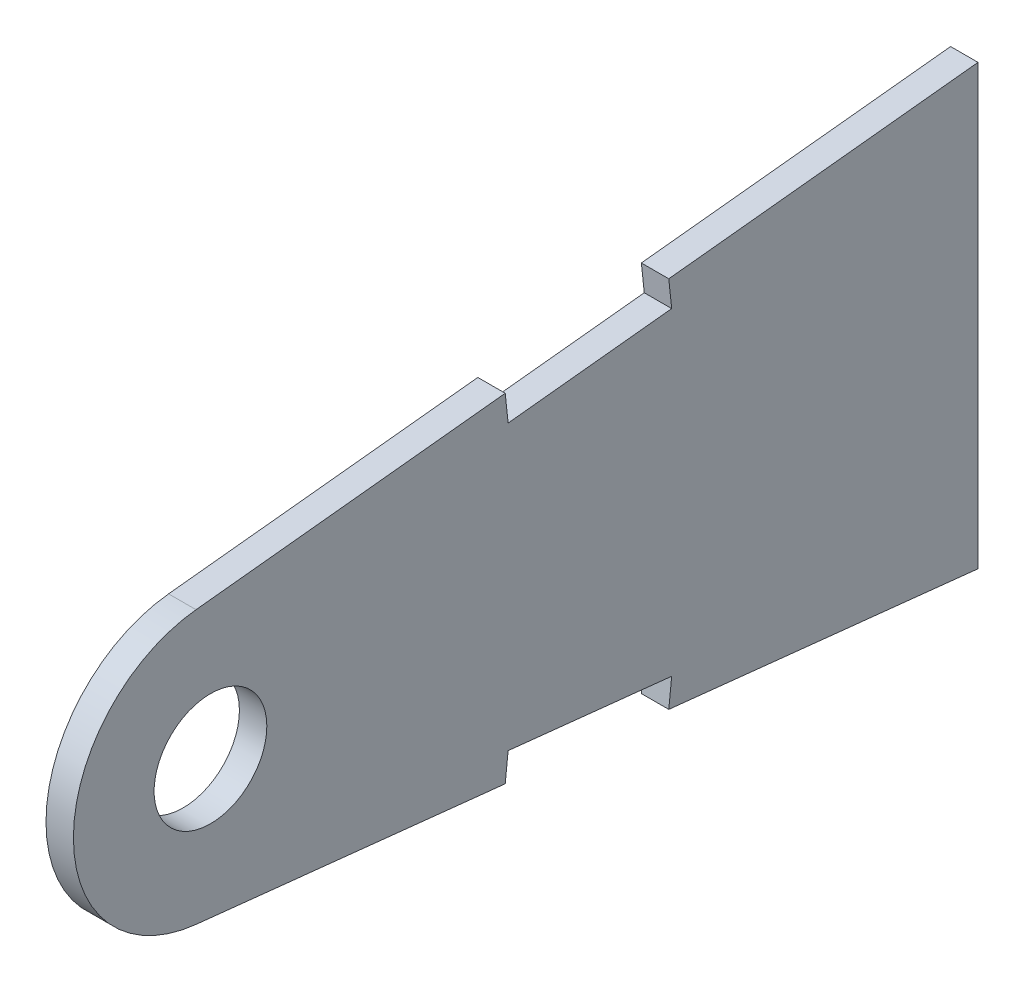
from build123d import *

# Parameters (mm, degrees)
BOSS_EXTRUDE1_DEPTH     = 1.5875
F_1_4_CLEARANCE_HOLE1_D = 6.5278


with BuildPart() as part:
    # Sketch1 → Boss-Extrude1 (new body)
    with BuildSketch(Plane(origin=(0, 0, 0), x_dir=(0, 0, -1), z_dir=(1, 0, 0))):
        with BuildLine():
            ThreePointArc((-0.837778906, 7.893163672), (-5.901431026, 5.308202906), (-7.9375, 0))
            Line((-7.9375, 0), (44.45, 0))
            Line((44.45, 0), (44.45, 12.7))
            Line((44.45, 12.7), (26.54200875, 10.79924918))
            Line((26.54200875, 10.79924918), (26.709564531, 9.220616445))
            Line((26.709564531, 9.220616445), (17.237768125, 8.215281758))
            Line((17.237768125, 8.215281758), (17.070212344, 9.793914492))
            Line((17.070212344, 9.793914492), (-0.837778906, 7.893163672))
        make_face()
        with BuildLine():
            ThreePointArc((-7.9375, 0), (-5.901431026, -5.308202906), (-0.837778906, -7.893163672))
            Line((-0.837778906, -7.893163672), (17.070212344, -9.793914492))
            Line((17.070212344, -9.793914492), (17.237768125, -8.215281758))
            Line((17.237768125, -8.215281758), (26.709564531, -9.220616445))
            Line((26.709564531, -9.220616445), (26.54200875, -10.79924918))
            Line((26.54200875, -10.79924918), (44.45, -12.7))
            Line((44.45, -12.7), (44.45, 0))
            Line((44.45, 0), (-7.9375, 0))
        make_face()
    extrude(amount=BOSS_EXTRUDE1_DEPTH)

    # 1/4 Clearance Hole1 (through all)
    with Locations(Plane(origin=(1.5875, 0, 0), x_dir=(0, 0, -1), z_dir=(1, 0, 0))):
        with Locations((0, 0)):
            Hole(F_1_4_CLEARANCE_HOLE1_D / 2)


solid = part.part
